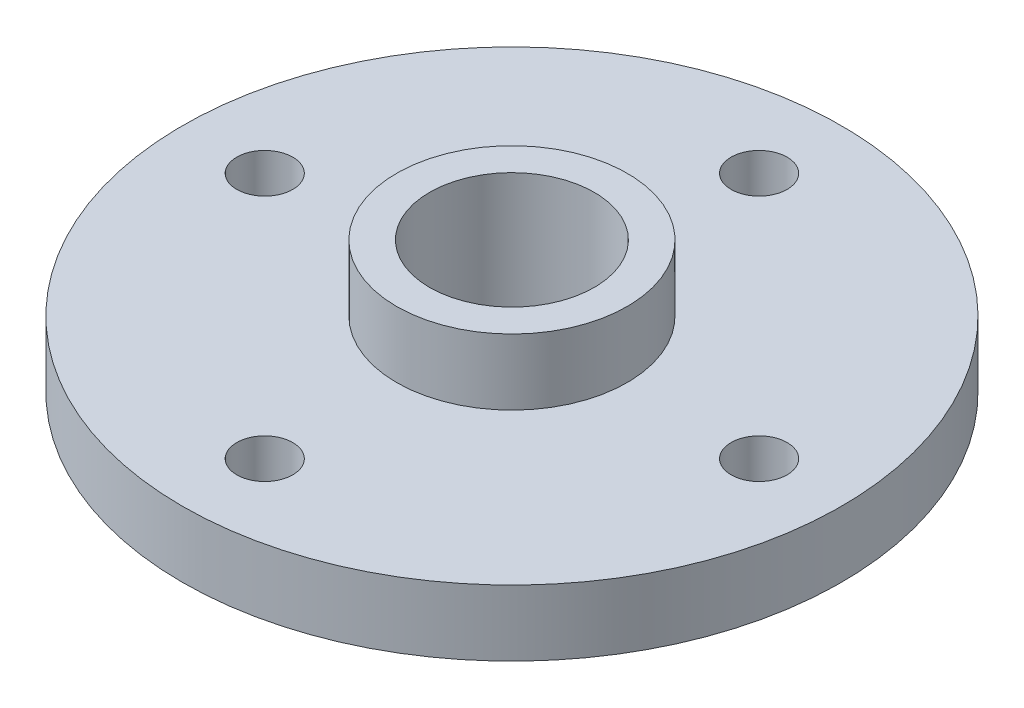
from build123d import *

# Parameters (mm, degrees)
SKETCH1_R           = 10
BOSS_EXTRUDE1_DEPTH = 2
SKETCH2_R           = 3.5
BOSS_EXTRUDE2_DEPTH = 2
SKETCH3_R           = 2.5
CUT_EXTRUDE1_DEPTH  = 15.696938457
SKETCH4_R           = 0.85
CUT_EXTRUDE2_DEPTH  = 15.282856857


with BuildPart() as part:
    # Sketch1 → Boss-Extrude1 (new body)
    with BuildSketch(Plane(origin=(0, 0, 0), x_dir=(1, 0, 0), z_dir=(0, 1, 0))):
        with Locations(Location((0, 0, 0), (0, 0, 270))):
            Circle(SKETCH1_R)
    extrude(amount=BOSS_EXTRUDE1_DEPTH)

    # Sketch2 → Boss-Extrude2 (add)
    with BuildSketch(Plane(origin=(0, 2, 0), x_dir=(1, 0, 0), z_dir=(0, 1, 0))):
        with Locations(Location((0, 0, 0), (0, 0, 270))):
            Circle(SKETCH2_R)
    extrude(amount=BOSS_EXTRUDE2_DEPTH)

    # Sketch3 → Cut-Extrude1 (cut, through all)
    with BuildSketch(Plane(origin=(0, 4, 0), x_dir=(1, 0, 0), z_dir=(0, 1, 0))):
        with Locations(Location((0, 0, 0), (0, 0, 270))):
            Circle(SKETCH3_R)
    extrude(amount=-CUT_EXTRUDE1_DEPTH, mode=Mode.SUBTRACT)

    # Sketch4 → Cut-Extrude2 (cut, through all)
    with BuildSketch(Plane(origin=(0, 2, 0), x_dir=(1, 0, 0), z_dir=(0, 1, 0))):
        with Locations(Location((0, 7.5, 0), (0, 0, 270))):
            Circle(SKETCH4_R)
        with Locations(Location((-7.5, 0, 0), (0, 0, 270))):
            Circle(SKETCH4_R)
        with Locations(Location((7.5, 0, 0), (0, 0, 270))):
            Circle(SKETCH4_R)
        with Locations(Location((0, -7.5, 0), (0, 0, 270))):
            Circle(SKETCH4_R)
    extrude(amount=-CUT_EXTRUDE2_DEPTH, mode=Mode.SUBTRACT)


solid = part.part
